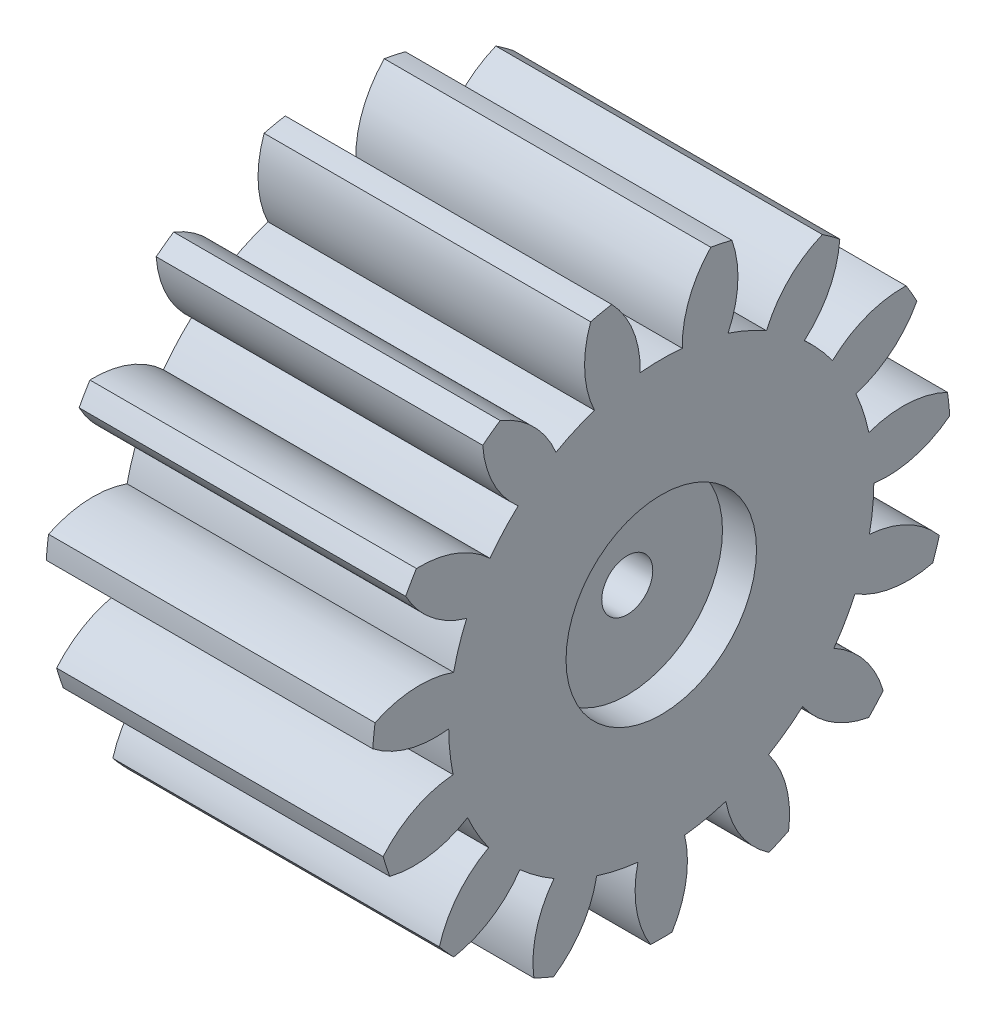
from build123d import *

# Parameters (mm, degrees)
BASPROSKE_W         = 8
BASPROSKE_H         = 8.5
TOOTHCUT_DEPTH      = 15.439529078
TEETHCUTS_COUNT     = 15
TEETHCUTS_ANGLE     = 336
BORSKE_R            = 0.75
BORE_DEPTH          = 50.0000508
SKETCH1_R           = 2.8
CUT_EXTRUDE2_DEPTH  = 1
BOSS_EXTRUDE2_START = 1.6
SKETCH2_R           = 0.75
BOSS_EXTRUDE2_DEPTH = 1.6


with BuildPart() as part:
    # BasProSke → Base-Revolve (revolve)
    with BuildSketch(Plane(origin=(0, 0, 0), x_dir=(1, 0, 0), z_dir=(0, 1, 0)), mode=Mode.PRIVATE) as base_revolve_sk:
        with Locations((4, 4.25)):
            Rectangle(BASPROSKE_W, BASPROSKE_H)
    revolve(base_revolve_sk.sketch.rotate(Axis((-10, 0, 0), (1, 0, 0)), 180), axis=Axis((-10, 0, 0), (1, 0, 0)))

    # TooCutSke → ToothCut (cut, through all)
    with BuildSketch(Plane(origin=(0, 0, 0), x_dir=(0, 0, -1), z_dir=(1, 0, 0))):
        with BuildLine():
            ThreePointArc((0.619547138, 6.21821215), (0, 6.249), (-0.619547138, 6.21821215))
            ThreePointArc((-0.619547138, 6.21821215), (-0.827197364, 7.394441061), (-1.477319646, 8.396426134))
            ThreePointArc((-1.477319646, 8.396426134), (0, 8.5254), (1.477319646, 8.396426134))
            ThreePointArc((1.477319646, 8.396426134), (0.827197364, 7.394441061), (0.619547138, 6.21821215))
        make_face()
    toothcut = extrude(amount=TOOTHCUT_DEPTH, mode=Mode.SUBTRACT)

    # TeethCuts: ToothCut ×15 about axis
    teethcuts_axis = Axis((-10, 0, 0), (1, 0, 0))
    for i in range(1, TEETHCUTS_COUNT):
        add(toothcut.rotate(teethcuts_axis, i * TEETHCUTS_ANGLE / (TEETHCUTS_COUNT - 1)), mode=Mode.SUBTRACT)

    # BorSke → Bore (cut, symmetric)
    with BuildSketch(Plane(origin=(0, 0, 0), x_dir=(0, 0, -1), z_dir=(1, 0, 0))):
        with Locations(Location((0, 0, 0), (0, 0, 180))):
            Circle(BORSKE_R)
    extrude(amount=BORE_DEPTH, both=True, mode=Mode.SUBTRACT)

    # Sketch1 → Cut-Extrude2 (cut)
    with BuildSketch(Plane(origin=(8, 0, 0), x_dir=(0, 0, -1), z_dir=(1, 0, 0))):
        Circle(SKETCH1_R)
    extrude(amount=-CUT_EXTRUDE2_DEPTH, mode=Mode.SUBTRACT)

    # Sketch2 → Boss-Extrude2 (add)
    with BuildSketch(Plane.ZY.offset(BOSS_EXTRUDE2_START)):
        with BuildLine():
            ThreePointArc((6.248908444, -0.033826967), (7.425583576, 0.045669992), (8.480693328, 0.572573726))
            ThreePointArc((8.480693328, 0.572573726), (8.453436111, 0.888491938), (8.414414603, 1.203173673))
            ThreePointArc((8.414414603, 1.203173673), (7.272812084, 1.499193643), (6.105321779, 1.332308887))
            ThreePointArc((6.105321779, 1.332308887), (5.94315217, 1.931047198), (5.722420591, 2.510757571))
            ThreePointArc((5.722420591, 2.510757571), (6.765032487, 3.061978551), (7.514612153, 3.972480862))
            ThreePointArc((7.514612153, 3.972480862), (7.361215932, 4.25), (7.197575419, 4.521604593))
            ThreePointArc((7.197575419, 4.521604593), (6.034267454, 4.327700716), (5.035590135, 3.700382817))
            ThreePointArc((5.035590135, 3.700382817), (4.643912014, 4.181397159), (4.206474231, 4.621209316))
            ThreePointArc((4.206474231, 4.621209316), (4.934745822, 5.5488432), (5.249186267, 6.685509968))
            ThreePointArc((5.249186267, 6.685509968), (4.996174644, 6.876644452), (4.736210056, 7.058209001))
            ThreePointArc((4.736210056, 7.058209001), (3.752343161, 6.407909019), (3.095159209, 5.428626941))
            ThreePointArc((3.095159209, 5.428626941), (2.541697283, 5.708745565), (1.963190262, 5.932611987))
            ThreePointArc((1.963190262, 5.932611987), (2.251196774, 7.076262451), (2.076128389, 8.242553664))
            ThreePointArc((2.076128389, 8.242553664), (1.767249372, 8.314254606), (1.455910948, 8.374384951))
            ThreePointArc((1.455910948, 8.374384951), (0.821604647, 7.380131638), (0.619547138, 6.21821215))
            ThreePointArc((0.619547138, 6.21821215), (0, 6.249), (-0.619547138, 6.21821215))
            ThreePointArc((-0.619547138, 6.21821215), (-0.821604647, 7.380131638), (-1.455910948, 8.374384951))
            ThreePointArc((-1.455910948, 8.374384951), (-1.767249372, 8.314254606), (-2.076128389, 8.242553664))
            ThreePointArc((-2.076128389, 8.242553664), (-2.251196774, 7.076262451), (-1.963190262, 5.932611987))
            ThreePointArc((-1.963190262, 5.932611987), (-2.541697283, 5.708745565), (-3.095159209, 5.428626941))
            ThreePointArc((-3.095159209, 5.428626941), (-3.752343161, 6.407909019), (-4.736210056, 7.058209001))
            ThreePointArc((-4.736210056, 7.058209001), (-4.996174644, 6.876644452), (-5.249186267, 6.685509968))
            ThreePointArc((-5.249186267, 6.685509968), (-4.934745822, 5.5488432), (-4.206474231, 4.621209316))
            ThreePointArc((-4.206474231, 4.621209316), (-4.643912014, 4.181397159), (-5.035590135, 3.700382817))
            ThreePointArc((-5.035590135, 3.700382817), (-6.034267454, 4.327700716), (-7.197575419, 4.521604593))
            ThreePointArc((-7.197575419, 4.521604593), (-7.361215932, 4.25), (-7.514612153, 3.972480862))
            ThreePointArc((-7.514612153, 3.972480862), (-6.765032487, 3.061978551), (-5.722420591, 2.510757571))
            ThreePointArc((-5.722420591, 2.510757571), (-5.94315217, 1.931047198), (-6.105321779, 1.332308887))
            ThreePointArc((-6.105321779, 1.332308887), (-7.272812084, 1.499193643), (-8.414414603, 1.203173673))
            ThreePointArc((-8.414414603, 1.203173673), (-8.453436111, 0.888491938), (-8.480693328, 0.572573726))
            ThreePointArc((-8.480693328, 0.572573726), (-7.425583576, 0.045669992), (-6.248908444, -0.033826967))
            ThreePointArc((-6.248908444, -0.033826967), (-6.214767324, -0.653198367), (-6.119387823, -1.266133354))
            ThreePointArc((-6.119387823, -1.266133354), (-7.253821434, -1.58853763), (-8.17632506, -2.323296905))
            ThreePointArc((-8.17632506, -2.323296905), (-8.083980389, -2.626644452), (-7.980385583, -2.926336609))
            ThreePointArc((-7.980385583, -2.926336609), (-6.802183806, -2.978535323), (-5.694903257, -2.572562515))
            ThreePointArc((-5.694903257, -2.572562515), (-5.411792748, -3.1245), (-5.075356119, -3.645649635))
            ThreePointArc((-5.075356119, -3.645649635), (-5.980579158, -4.401596316), (-6.524474635, -5.448048342))
            ThreePointArc((-6.524474635, -5.448048342), (-6.316731017, -5.687610154), (-6.100196671, -5.919256759))
            ThreePointArc((-6.100196671, -5.919256759), (-5.002624659, -5.487724821), (-4.156197561, -4.666478633))
            ThreePointArc((-4.156197561, -4.666478633), (-3.673070042, -5.055547198), (-3.153749234, -5.394799975))
            ThreePointArc((-3.153749234, -5.394799975), (-3.673240415, -6.453579011), (-3.744483272, -7.630782727))
            ThreePointArc((-3.744483272, -7.630782727), (-3.457261466, -7.76513639), (-3.165228336, -7.888683641))
            ThreePointArc((-3.165228336, -7.888683641), (-2.338066262, -7.048036844), (-1.898847548, -5.953518203))
            ThreePointArc((-1.898847548, -5.953518203), (-1.299240156, -6.112444357), (-0.686830456, -6.211140388))
            ThreePointArc((-0.686830456, -6.211140388), (-0.730765033, -7.389679266), (-0.317036734, -8.494085455))
            ThreePointArc((-0.317036734, -8.494085455), (0, -8.5), (0.317036734, -8.494085455))
            ThreePointArc((0.317036734, -8.494085455), (0.730765033, -7.389679266), (0.686830456, -6.211140388))
            ThreePointArc((0.686830456, -6.211140388), (1.299240156, -6.112444357), (1.898847548, -5.953518203))
            ThreePointArc((1.898847548, -5.953518203), (2.338066262, -7.048036844), (3.165228336, -7.888683641))
            ThreePointArc((3.165228336, -7.888683641), (3.457261466, -7.76513639), (3.744483272, -7.630782727))
            ThreePointArc((3.744483272, -7.630782727), (3.673240415, -6.453579011), (3.153749234, -5.394799975))
            ThreePointArc((3.153749234, -5.394799975), (3.673070042, -5.055547198), (4.156197561, -4.666478633))
            ThreePointArc((4.156197561, -4.666478633), (5.002624659, -5.487724821), (6.100196671, -5.919256759))
            ThreePointArc((6.100196671, -5.919256759), (6.316731017, -5.687610154), (6.524474635, -5.448048342))
            ThreePointArc((6.524474635, -5.448048342), (5.980579158, -4.401596316), (5.075356119, -3.645649635))
            ThreePointArc((5.075356119, -3.645649635), (5.411792748, -3.1245), (5.694903257, -2.572562515))
            ThreePointArc((5.694903257, -2.572562515), (6.802183806, -2.978535323), (7.980385583, -2.926336609))
            ThreePointArc((7.980385583, -2.926336609), (8.083980389, -2.626644452), (8.17632506, -2.323296905))
            ThreePointArc((8.17632506, -2.323296905), (7.253821434, -1.58853763), (6.119387823, -1.266133354))
            ThreePointArc((6.119387823, -1.266133354), (6.214767324, -0.653198367), (6.248908444, -0.033826967))
        make_face()
        Circle(SKETCH2_R, mode=Mode.SUBTRACT)
    extrude(amount=-BOSS_EXTRUDE2_DEPTH)


solid = part.part
